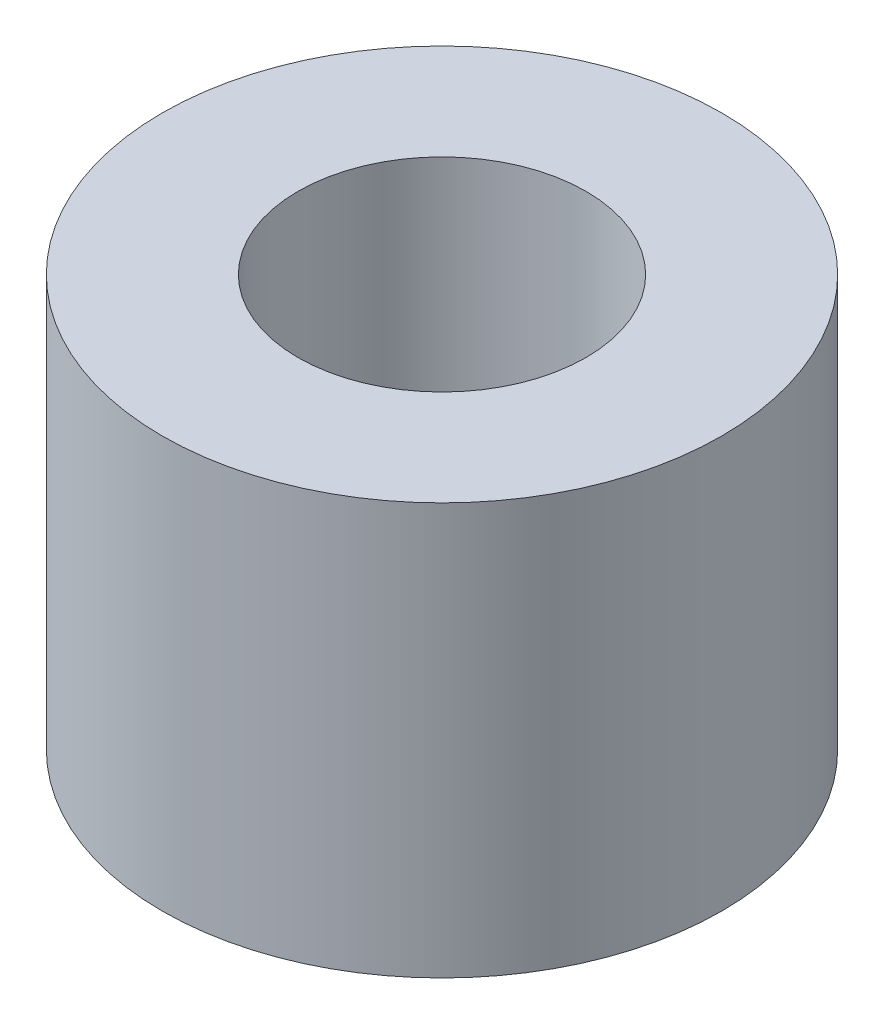
from build123d import *

# Parameters (mm, degrees)
SKETCH1_R           = 3.4
SKETCH1_R_2         = 1.75
BOSS_EXTRUDE1_DEPTH = 5


with BuildPart() as part:
    # Sketch1 → Boss-Extrude1 (new body)
    with BuildSketch(Plane(origin=(0, 0, 0), x_dir=(1, 0, 0), z_dir=(0, 1, 0))):
        with Locations(Location((0, 0, 0), (0, 0, 270))):
            Circle(SKETCH1_R)
        with Locations(Location((0, 0, 0), (0, 0, 270))):
            Circle(SKETCH1_R_2, mode=Mode.SUBTRACT)
    extrude(amount=BOSS_EXTRUDE1_DEPTH)


solid = part.part
